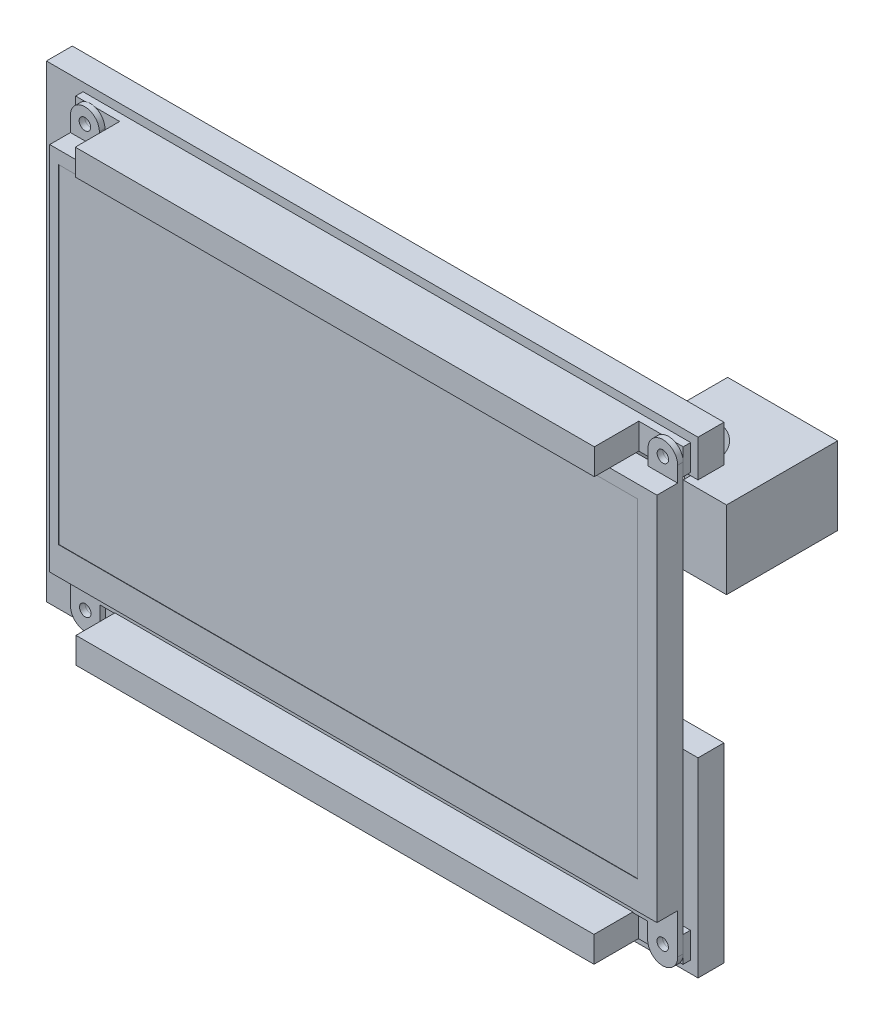
from build123d import *

# Parameters (mm, degrees)
SKETCH1_W             = 164
SKETCH1_H             = 106.5
SKETCH1_R             = 1.55
BOSS_EXTRUDE1_DEPTH   = 1.5
BOSS_EXTRUDE2_START   = -1.5
SKETCH3_W             = 164
SKETCH3_H             = 100
SKETCH3_W_2           = 156.4
SKETCH3_H_2           = 88.9
BOSS_EXTRUDE2_DEPTH   = 7.1
BOSS_EXTRUDE3_START   = -1.5
SKETCH3_2_W           = 156.4
SKETCH3_2_H           = 88.9
BOSS_EXTRUDE3_DEPTH   = 7
SKETCH4_W             = 164
SKETCH4_H             = 65
BOSS_EXTRUDE4_DEPTH   = 6
SKETCH5_W             = 11.7
SKETCH5_H             = 21
BOSS_EXTRUDE5_DEPTH   = 30
SKETCH6_W             = 11.6
SKETCH6_H             = 21
BOSS_EXTRUDE6_DEPTH   = 18
FILLET1_R             = 10
BOSS_EXTRUDE7_START   = 2
SKETCH7_R             = 1.55
SKETCH7_W             = 3
SKETCH7_H             = 13
BOSS_EXTRUDE7_DEPTH   = 4
CUT_EXTRUDE2_DEPTH    = 6
SKETCH11_W            = 176
SKETCH11_H            = 25
SKETCH11_R            = 1.55
SKETCH11_W_2          = 3
SKETCH11_H_2          = 13
BOSS_EXTRUDE8_DEPTH   = 3
SKETCH12_W            = 8
SKETCH12_H            = 20
CUT_EXTRUDE3_DEPTH    = 3
SKETCH13_R            = 2.1
CUT_EXTRUDE4_DEPTH    = 3
SKETCH14_W            = 164.1
SKETCH14_H            = 7
BOSS_EXTRUDE9_DEPTH   = 2
SKETCH14_W_2          = 163.95
BOSS_EXTRUDE9_2_DEPTH = 2
SKETCH14_3_W          = 140.2
SKETCH14_3_H          = 7
SKETCH14_3_W_2        = 3
SKETCH14_3_H_2        = 2.65
BOSS_EXTRUDE10_DEPTH  = 14
SKETCH15_R            = 1.55
CUT_EXTRUDE5_DEPTH    = 2.5
CUT_EXTRUDE6_DEPTH    = 3.1
SKETCH16_R            = 1.55
CUT_EXTRUDE7_DEPTH    = 10
BOSS_EXTRUDE12_DEPTH  = 3


with BuildPart() as part:
    # Sketch1 → Boss-Extrude1 (new body)
    # profile 1 of 5: a face of its own
    with BuildSketch(Plane.XY):
        Rectangle(SKETCH1_W, SKETCH1_H)
    # profile 2 of 5: a face of its own
    with BuildSketch(Plane.XY):
        with BuildLine():
            Line((-74, -53.25), (-82, -53.25))
            Line((-82, -53.25), (-82, -57.45))
            ThreePointArc((-82, -57.45), (-78, -61.45), (-74, -57.45))
            Line((-74, -57.45), (-74, -53.25))
        make_face()
        with Locations((-78, -56.5)):
            Circle(SKETCH1_R, mode=Mode.SUBTRACT)
    # profile 3 of 5: a face of its own
    with BuildSketch(Plane.XY):
        with BuildLine():
            Line((82, -53.25), (73.9, -53.25))
            Line((73.9, -53.25), (73.9, -57.6))
            ThreePointArc((73.9, -57.6), (77.95, -61.65), (82, -57.6))
            Line((82, -57.6), (82, -53.25))
        make_face()
        with Locations((77.95, -56.6)):
            Circle(SKETCH1_R, mode=Mode.SUBTRACT)
    # profile 4 of 5: a face of its own
    with BuildSketch(Plane.XY):
        with BuildLine():
            Line((-82, 57.35), (-82, 53.25))
            Line((-82, 53.25), (-74.2, 53.25))
            Line((-74.2, 53.25), (-74.2, 57.35))
            ThreePointArc((-74.2, 57.35), (-78.1, 61.25), (-82, 57.35))
        make_face()
        with Locations((-78.1, 57.2)):
            Circle(SKETCH1_R, mode=Mode.SUBTRACT)
    # profile 5 of 5: a face of its own
    with BuildSketch(Plane.XY):
        with BuildLine():
            Line((74, 57.45), (74, 53.25))
            Line((74, 53.25), (82, 53.25))
            Line((82, 53.25), (82, 57.45))
            ThreePointArc((82, 57.45), (78, 61.45), (74, 57.45))
        make_face()
        with Locations((78, 57.5)):
            Circle(SKETCH1_R, mode=Mode.SUBTRACT)
    extrude(amount=BOSS_EXTRUDE1_DEPTH)

    # Sketch3 → Boss-Extrude2 (add)
    with BuildSketch(Plane.XY.offset(1.5).offset(BOSS_EXTRUDE2_START)):
        with Locations((0, 3.25)):
            Rectangle(SKETCH3_W, SKETCH3_H)
        with Locations((-1.4, 5.3)):
            Rectangle(SKETCH3_W_2, SKETCH3_H_2, mode=Mode.SUBTRACT)
    extrude(amount=BOSS_EXTRUDE2_DEPTH)

    # Sketch3<2> → Boss-Extrude3 (add)
    with BuildSketch(Plane.XY.offset(1.5).offset(BOSS_EXTRUDE3_START)):
        with Locations((-1.4, 5.3)):
            Rectangle(SKETCH3_2_W, SKETCH3_2_H)
    extrude(amount=BOSS_EXTRUDE3_DEPTH)

    # Sketch4 → Boss-Extrude4 (add)
    with BuildSketch(Plane(origin=(0, 0, 0), x_dir=(-1, 0, 0), z_dir=(0, 0, -1))):
        with Locations((0, 20.75)):
            Rectangle(SKETCH4_W, SKETCH4_H)
    extrude(amount=BOSS_EXTRUDE4_DEPTH)

    # Sketch5 → Boss-Extrude5 (add)
    with BuildSketch(Plane(origin=(0, 0, 0), x_dir=(-1, 0, 0), z_dir=(0, 0, -1))):
        with Locations((-87.85, 42.75)):
            Rectangle(SKETCH5_W, SKETCH5_H)
    extrude(amount=BOSS_EXTRUDE5_DEPTH)

    # Sketch6 → Boss-Extrude6 (add)
    with BuildSketch(Plane.ZY.offset(-82)):
        with Locations((-24.2, 42.75)):
            Rectangle(SKETCH6_W, SKETCH6_H)
    extrude(amount=BOSS_EXTRUDE6_DEPTH)

    # Fillet1
    fillet1_edges = [part.edges().sort_by_distance(p)[0] for p in [
        (82, 42.75, -18.4),
    ]]
    fillet(fillet1_edges, radius=FILLET1_R)

    # Sketch8 → Cut-Extrude2 (cut)
    with BuildSketch(Plane(origin=(0, 0, -6), x_dir=(-1, 0, 0), z_dir=(0, 0, -1))):
        Polygon((-82, 53.25), (-82, 32.25), (-82, -11.75), (82, -11.75), (82, 53.25), align=None)
    extrude(amount=-CUT_EXTRUDE2_DEPTH, mode=Mode.SUBTRACT)


with BuildPart() as body_2:
    # Sketch7 → Boss-Extrude7 (new body)
    with BuildSketch(Plane(origin=(0, 0, 0), x_dir=(-1, 0, 0), z_dir=(0, 0, -1)).offset(BOSS_EXTRUDE7_START)):
        Polygon((-84, 63.25), (92, 63.25), (92, 18.282419046), (92, -63.25), (-84, -63.25), (-84, -39.97849009), (-84, -11.75), (-67, -11.75), (-67, 53.25), (-84, 53.25), align=None)
        with Locations((78.1, 57.2)):
            Circle(SKETCH7_R, mode=Mode.SUBTRACT)
        with Locations((78, -56.5)):
            Circle(SKETCH7_R, mode=Mode.SUBTRACT)
        with Locations((-77.95, -56.6)):
            Circle(SKETCH7_R, mode=Mode.SUBTRACT)
        with Locations((-78, 57.5)):
            Circle(SKETCH7_R, mode=Mode.SUBTRACT)
        Polygon((-57, 43.25), (72, 43.25), (72, -35.25), (-72, -35.25), (-72, -21.75), (-57, -21.75), align=None, mode=Mode.SUBTRACT)
        with Locations((-7.6, -49.25)):
            Rectangle(SKETCH7_W, SKETCH7_H, mode=Mode.SUBTRACT)
        with Locations((10.4, -49.25)):
            Rectangle(SKETCH7_W, SKETCH7_H, mode=Mode.SUBTRACT)
    extrude(amount=BOSS_EXTRUDE7_DEPTH)

    # Sketch11 → Boss-Extrude8 (add)
    # profile 1 of 3: a face of its own
    with BuildSketch(Plane(origin=(0, 0, -6), x_dir=(-1, 0, 0), z_dir=(0, 0, -1))):
        with Locations((4, -50.75)):
            Rectangle(SKETCH11_W, SKETCH11_H)
        with Locations(Location((-77.95, -56.6, 0), (0, 0, 180))):
            Circle(SKETCH11_R, mode=Mode.SUBTRACT)
        with Locations((-7.6, -49.25)):
            Rectangle(SKETCH11_W_2, SKETCH11_H_2, mode=Mode.SUBTRACT)
        with Locations((10.4, -49.25)):
            Rectangle(SKETCH11_W_2, SKETCH11_H_2, mode=Mode.SUBTRACT)
        with Locations(Location((78, -56.5, 0), (0, 0, 180))):
            Circle(SKETCH11_R, mode=Mode.SUBTRACT)
    # profile 2 of 3: a face of its own
    with BuildSketch(Plane(origin=(0, 0, -6), x_dir=(-1, 0, 0), z_dir=(0, 0, -1))):
        Polygon((-84, -11.75), (-84, -38.25), (92, -38.25), (92, 5.532), (72, 5.532), (72, -35.25), (-72, -35.25), (-72, -21.75), (-57, -21.75), (-57, 5.532), (-67, 5.532), (-67, -11.75), align=None)
    # profile 3 of 3: a face of its own
    with BuildSketch(Plane(origin=(0, 0, -6), x_dir=(-1, 0, 0), z_dir=(0, 0, -1))):
        Polygon((72, -35.25), (72, 5.532), (-57, 5.532), (-57, -21.75), (-72, -21.75), (-72, -35.25), align=None)
    extrude(amount=BOSS_EXTRUDE8_DEPTH)

    # Sketch12 → Cut-Extrude3 (cut)
    with BuildSketch(Plane(origin=(0, 0, -9), x_dir=(-1, 0, 0), z_dir=(0, 0, -1))):
        with Locations((-32.6, -16.359)):
            Rectangle(SKETCH12_W, SKETCH12_H)
        with Locations((35.4, -16.359)):
            Rectangle(SKETCH12_W, SKETCH12_H)
    extrude(amount=-CUT_EXTRUDE3_DEPTH, mode=Mode.SUBTRACT)

    # Sketch13 → Cut-Extrude4 (cut)
    with BuildSketch(Plane(origin=(0, 0, -9), x_dir=(-1, 0, 0), z_dir=(0, 0, -1))):
        with Locations((-32.6, -2.359)):
            Circle(SKETCH13_R)
        with Locations((35.4, -2.359)):
            Circle(SKETCH13_R)
        with Locations((35.4, -30.359)):
            Circle(SKETCH13_R)
        with Locations((-32.6, -30.359)):
            Circle(SKETCH13_R)
    extrude(amount=-CUT_EXTRUDE4_DEPTH, mode=Mode.SUBTRACT)

    # Sketch15 → Cut-Extrude5 (cut)
    # profile 1 of 2: a face of its own
    with BuildSketch(Plane(origin=(0, 0, -9), x_dir=(-1, 0, 0), z_dir=(0, 0, -1))):
        Polygon((79.616580754, -53.7), (76.383419246, -53.7), (74.766838493, -56.5), (76.383419246, -59.3), (79.616580754, -59.3), (81.233161507, -56.5), align=None)
        with Locations(Location((78, -56.5, 0), (0, 0, 180))):
            Circle(SKETCH15_R, mode=Mode.SUBTRACT)
    # profile 2 of 2: a face of its own
    with BuildSketch(Plane(origin=(0, 0, -9), x_dir=(-1, 0, 0), z_dir=(0, 0, -1))):
        Polygon((-76.333419246, -59.4), (-74.716838493, -56.6), (-76.333419246, -53.8), (-79.566580754, -53.8), (-81.183161507, -56.6), (-79.566580754, -59.4), align=None)
    extrude(amount=-CUT_EXTRUDE5_DEPTH, mode=Mode.SUBTRACT)

    # Sketch15<3> → Cut-Extrude6 (cut)
    with BuildSketch(Plane(origin=(0, 0, -9), x_dir=(-1, 0, 0), z_dir=(0, 0, -1))):
        Polygon((-74.766838493, 57.5), (-76.383419246, 60.3), (-79.616580754, 60.3), (-81.233161507, 57.5), (-79.616580754, 54.7), (-76.383419246, 54.7), align=None)
        Polygon((74.866838493, 57.2), (76.483419246, 54.4), (79.716580754, 54.4), (81.333161507, 57.2), (79.716580754, 60), (76.483419246, 60), align=None)
    extrude(amount=-CUT_EXTRUDE6_DEPTH, mode=Mode.SUBTRACT)

    # Sketch17 → Boss-Extrude12 (add)
    with BuildSketch(Plane(origin=(0, 0, -6), x_dir=(-1, 0, 0), z_dir=(0, 0, -1))):
        Polygon((-67, 53.25), (-67, 5.532), (-57, 5.532), (-57, 43.25), (72, 43.25), (72, 5.532), (92, 5.532), (92, 63.25), (-84, 63.25), (-84, 53.25), align=None)
        Polygon((79.716580754, 54.4), (81.333161507, 57.2), (79.716580754, 60), (76.483419246, 60), (74.866838493, 57.2), (76.483419246, 54.4), align=None, mode=Mode.SUBTRACT)
        Polygon((-76.383419246, 54.7), (-74.766838493, 57.5), (-76.383419246, 60.3), (-79.616580754, 60.3), (-81.233161507, 57.5), (-79.616580754, 54.7), align=None, mode=Mode.SUBTRACT)
    extrude(amount=BOSS_EXTRUDE12_DEPTH)


with BuildPart() as cut_extrude2_piece_1:
    # of the separate pieces the step leaves, piece 1, a body of its own (cut_extrude2_pieces)
    add(part.part.solids().sort_by_distance((-82, -57.45, 0))[0])


with BuildPart() as cut_extrude2_piece_2:
    # of the separate pieces the step leaves, piece 2, a body of its own (cut_extrude2_pieces)
    add(part.part.solids().sort_by_distance((72, 53.25, -18.4))[0])


with BuildPart() as body_4:
    # Sketch14 → Boss-Extrude9 (new body)
    with BuildSketch(Plane.XY.offset(-2)):
        with Locations((-0.05, 57.5)):
            Rectangle(SKETCH14_W, SKETCH14_H)
    extrude(amount=BOSS_EXTRUDE9_DEPTH)



with BuildPart() as body_5:
    # Sketch14 → Boss-Extrude9 2 (new body)
    with BuildSketch(Plane.XY.offset(-2)):
        with Locations((-0.025, -56.6)):
            Rectangle(SKETCH14_W_2, SKETCH14_H)
    extrude(amount=BOSS_EXTRUDE9_2_DEPTH)


with BuildPart() as body_4_1:
    add(body_4.part)

    add(body_5.part)  # Boss-Extrude10 merges body 5
    # Sketch14<3> → Boss-Extrude10 (add)
    with BuildSketch(Plane.XY.offset(-2)):
        with Locations((-0.1, 57.5)):
            Rectangle(SKETCH14_3_W, SKETCH14_3_H)
        Polygon((-11.9, -53.1), (-70, -53.1), (-70, -60.1), (69.9, -60.1), (69.9, -53.1), (9.1, -53.1), (9.1, -55.75), (6.1, -55.75), (6.1, -53.1), (-8.9, -53.1), (-8.9, -55.75), (-11.9, -55.75), align=None)
        with Locations((-10.4, -54.425)):
            Rectangle(SKETCH14_3_W_2, SKETCH14_3_H_2)
        with Locations((7.6, -54.425)):
            Rectangle(SKETCH14_3_W_2, SKETCH14_3_H_2)
    extrude(amount=BOSS_EXTRUDE10_DEPTH)

    # Sketch16 → Cut-Extrude7 (cut)
    with BuildSketch(Plane.XY.offset(1.5)):
        with Locations((-78, -56.5)):
            Circle(SKETCH16_R)
        with Locations((77.95, -56.6)):
            Circle(SKETCH16_R)
        with Locations((78, 57.5)):
            Circle(SKETCH16_R)
        with Locations((-78.1, 57.2)):
            Circle(SKETCH16_R)
    extrude(amount=-CUT_EXTRUDE7_DEPTH, mode=Mode.SUBTRACT)


solid = Compound([body_2.part, cut_extrude2_piece_1.part, cut_extrude2_piece_2.part, body_4_1.part])
